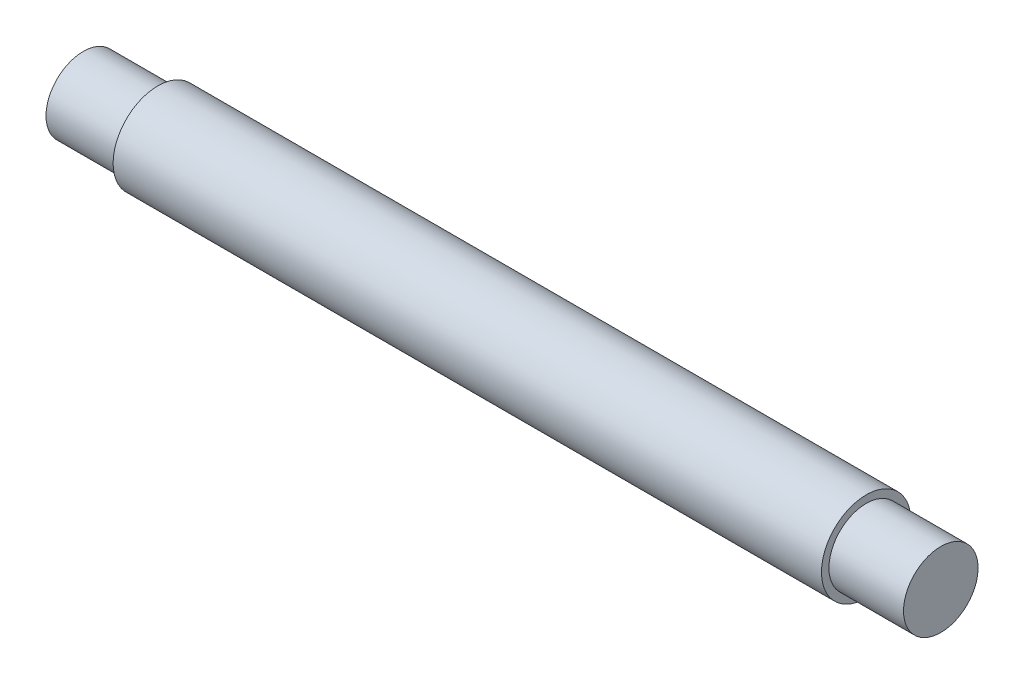
from build123d import *


with BuildPart() as part:
    # Sketch1 → Revolve1 (revolve)
    with BuildSketch(Plane(origin=(0, 0, 0), x_dir=(1, 0, 0), z_dir=(0, 1, 0)), mode=Mode.PRIVATE) as revolve1_sk:
        Polygon((115, 0), (115, 5), (105, 5), (105, 6), (10, 6), (10, 5), (0, 5), (0, 0), align=None)
    revolve(revolve1_sk.sketch.rotate(Axis((0, 0, 0), (1, 0, 0)), 180), axis=Axis((0, 0, 0), (1, 0, 0)))


solid = part.part
